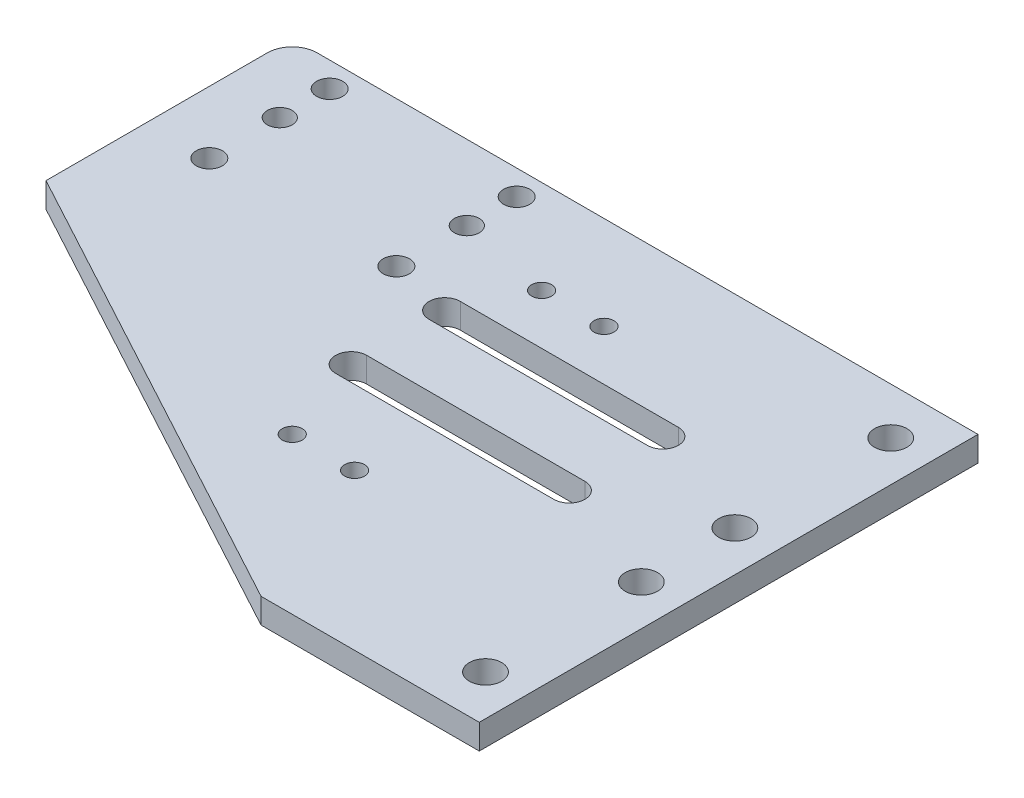
from build123d import *

# Parameters (mm, degrees)
SKETCH_1_W          = 110
SKETCH_1_H          = 80
EXTRUDE_1_DEPTH     = 4
SKETCH_2_R          = 2.1
CUT_EXTRUDE_1_DEPTH = 4
FILLET_1_R          = 4
FILLET_2_R          = 5
SKETCH_4_R          = 2.6
CUT_EXTRUDE_2_DEPTH = 10
SKETCH_5_R          = 1.6
CUT_EXTRUDE_3_DEPTH = 10
CUT_EXTRUDE_4_DEPTH = 10
CUT_EXTRUDE_6_REACH = 138.074
SKETCH_8_R          = 2
CUT_EXTRUDE_7_DEPTH = 137.073509545


with BuildPart() as part:
    # 草图1 → 凸台-拉伸1 (new body)
    with BuildSketch(Plane(origin=(0, 0, 0), x_dir=(1, 0, 0), z_dir=(0, 1, 0))):
        with Locations((55, 40)):
            Rectangle(SKETCH_1_W, SKETCH_1_H)
    extrude(amount=EXTRUDE_1_DEPTH)

    # 草图2 → 切除-拉伸1 (cut)
    with BuildSketch(Plane(origin=(0, 4, 0), x_dir=(1, 0, 0), z_dir=(0, 1, 0))):
        with Locations(Location((10, 56.7, 0), (0, 0, 270))):
            Circle(SKETCH_2_R)
        with Locations(Location((40, 56.7, 0), (0, 0, 90))):
            Circle(SKETCH_2_R)
        with Locations(Location((10, 76, 0), (0, 0, 270))):
            Circle(SKETCH_2_R)
        with Locations(Location((40, 76, 0), (0, 0, 90))):
            Circle(SKETCH_2_R)
    extrude(amount=-CUT_EXTRUDE_1_DEPTH, mode=Mode.SUBTRACT)

    # 圆角1
    fillet_1_edges = [part.edges().sort_by_distance(p)[0] for p in [
        (0, 2, -80),
    ]]
    fillet(fillet_1_edges, radius=FILLET_1_R)

    # 圆角2
    fillet_2_edges = [part.edges().sort_by_distance(p)[0] for p in [
        (0, 2, 0),
    ]]
    fillet(fillet_2_edges, radius=FILLET_2_R)

    # 草图4 → 切除-拉伸2 (cut)
    with BuildSketch(Plane(origin=(0, 4, 0), x_dir=(1, 0, 0), z_dir=(0, 1, 0))):
        with Locations(Location((103.5, 47.5, 0), (0, 0, 270))):
            Circle(SKETCH_4_R)
        with Locations(Location((103.5, 72.5, 0), (0, 0, 270))):
            Circle(SKETCH_4_R)
        with Locations(Location((103.5, 7.5, 0), (0, 0, 90))):
            Circle(SKETCH_4_R)
        with Locations(Location((103.5, 32.5, 0), (0, 0, 90))):
            Circle(SKETCH_4_R)
    extrude(amount=-CUT_EXTRUDE_2_DEPTH, mode=Mode.SUBTRACT)

    # 草图5 → 切除-拉伸3 (cut)
    with BuildSketch(Plane.XZ):
        with Locations(Location((55, -65, 0), (0, 0, 270))):
            Circle(SKETCH_5_R)
        with Locations(Location((65, -65, 0), (0, 0, 270))):
            Circle(SKETCH_5_R)
    cut_extrude_3 = extrude(amount=-CUT_EXTRUDE_3_DEPTH, mode=Mode.SUBTRACT)

    # 草图6 → 切除-拉伸4 (cut)
    with BuildSketch(Plane.XZ):
        Polygon((0, -40.5), (75, 0), (0, 0), align=None)
    extrude(amount=-CUT_EXTRUDE_4_DEPTH, mode=Mode.SUBTRACT)

    # 草图8 → 切除-拉伸6 (cut, up to next)
    with BuildSketch(Plane.XZ, mode=Mode.PRIVATE) as cut_extrude_6_sk1:
        with Locations(Location((10, -68, 0), (0, 0, 270))):
            Circle(SKETCH_8_R)
    cut_extrude_6_tool1 = extrude(cut_extrude_6_sk1.sketch, amount=-CUT_EXTRUDE_6_REACH, mode=Mode.PRIVATE) & part.part
    # 草图8 → 切除-拉伸6 (cut, up to next)
    with BuildSketch(Plane.XZ, mode=Mode.PRIVATE) as cut_extrude_6_sk2:
        with Locations(Location((40, -68, 0), (0, 0, 270))):
            Circle(SKETCH_8_R)
    cut_extrude_6_tool2 = extrude(cut_extrude_6_sk2.sketch, amount=-CUT_EXTRUDE_6_REACH, mode=Mode.PRIVATE) & part.part
    add(cut_extrude_6_tool1.solids().sort_by_distance((10, 0, -68))[0], mode=Mode.SUBTRACT)
    add(cut_extrude_6_tool2.solids().sort_by_distance((40, 0, -68))[0], mode=Mode.SUBTRACT)

    # 镜向1: 切除-拉伸3 across plane
    add(cut_extrude_3.mirror(Plane(origin=(0, 0, -45), x_dir=(1, 0, 0), z_dir=(0, 0, -1))), mode=Mode.SUBTRACT)

    # 草图9 → 切除-拉伸7 (cut, through all)
    with BuildSketch(Plane.XZ):
        with BuildLine():
            Line((85, -36.949085991), (50, -36.949085991))
            ThreePointArc((50, -36.949085991), (47.5, -39.449085991), (50, -41.949085991))
            Line((50, -41.949085991), (85, -41.949085991))
            ThreePointArc((85, -41.949085991), (87.5, -39.449085991), (85, -36.949085991))
        make_face()
        with BuildLine():
            Line((85, -51.949085991), (50, -51.949085991))
            ThreePointArc((50, -51.949085991), (47.5, -54.449085991), (50, -56.949085991))
            Line((50, -56.949085991), (85, -56.949085991))
            ThreePointArc((85, -56.949085991), (87.5, -54.449085991), (85, -51.949085991))
        make_face()
    extrude(amount=-CUT_EXTRUDE_7_DEPTH, mode=Mode.SUBTRACT)


solid = part.part
